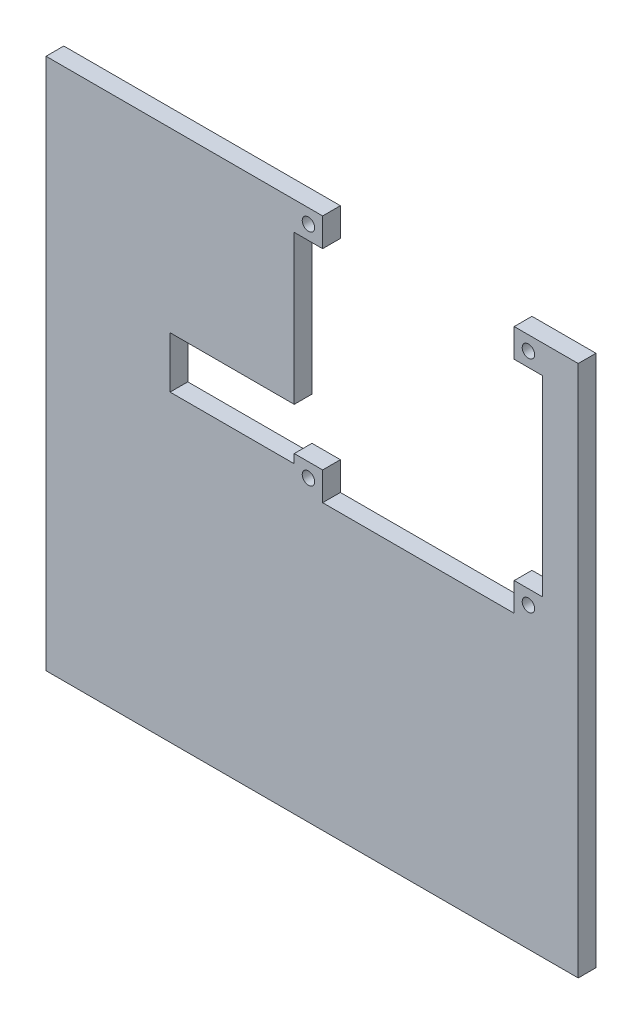
from build123d import *

# Parameters (mm, degrees)
SKETCH1_W           = 150
SKETCH1_H           = 150
BOSS_EXTRUDE1_DEPTH = 5
SKETCH2_R           = 1.75
CUT_EXTRUDE1_DEPTH  = 213.190951739
SKETCH3_W           = 35
SKETCH3_H           = 14.5
CUT_EXTRUDE2_DEPTH  = 213.190951739


with BuildPart() as part:
    # Sketch1 → Boss-Extrude1 (new body)
    with BuildSketch(Plane.XY):
        with Locations((75, 75)):
            Rectangle(SKETCH1_W, SKETCH1_H)
    extrude(amount=BOSS_EXTRUDE1_DEPTH)

    # Sketch2 → Cut-Extrude1 (cut, through all)
    with BuildSketch(Plane.XY.offset(5)):
        with Locations((73.960018565, 84)):
            Circle(SKETCH2_R)
        with Locations((73.960018565, 146)):
            Circle(SKETCH2_R)
        with Locations((135.960018565, 146)):
            Circle(SKETCH2_R)
        with Locations((135.960018565, 84)):
            Circle(SKETCH2_R)
        Polygon((77.960018565, 150), (131.960018565, 150), (131.960018565, 142), (139.960018565, 142), (139.960018565, 88), (131.960018565, 88), (131.960018565, 80), (77.960018565, 80), (77.960018565, 88), (69.960018565, 88), (69.960018565, 142), (77.960018565, 142), align=None)
    extrude(amount=-CUT_EXTRUDE1_DEPTH, mode=Mode.SUBTRACT)

    # Sketch3 → Cut-Extrude2 (cut, through all)
    with BuildSketch(Plane.XY.offset(5)):
        with Locations((52.460018565, 92.75)):
            Rectangle(SKETCH3_W, SKETCH3_H)
    extrude(amount=-CUT_EXTRUDE2_DEPTH, mode=Mode.SUBTRACT)


solid = part.part
